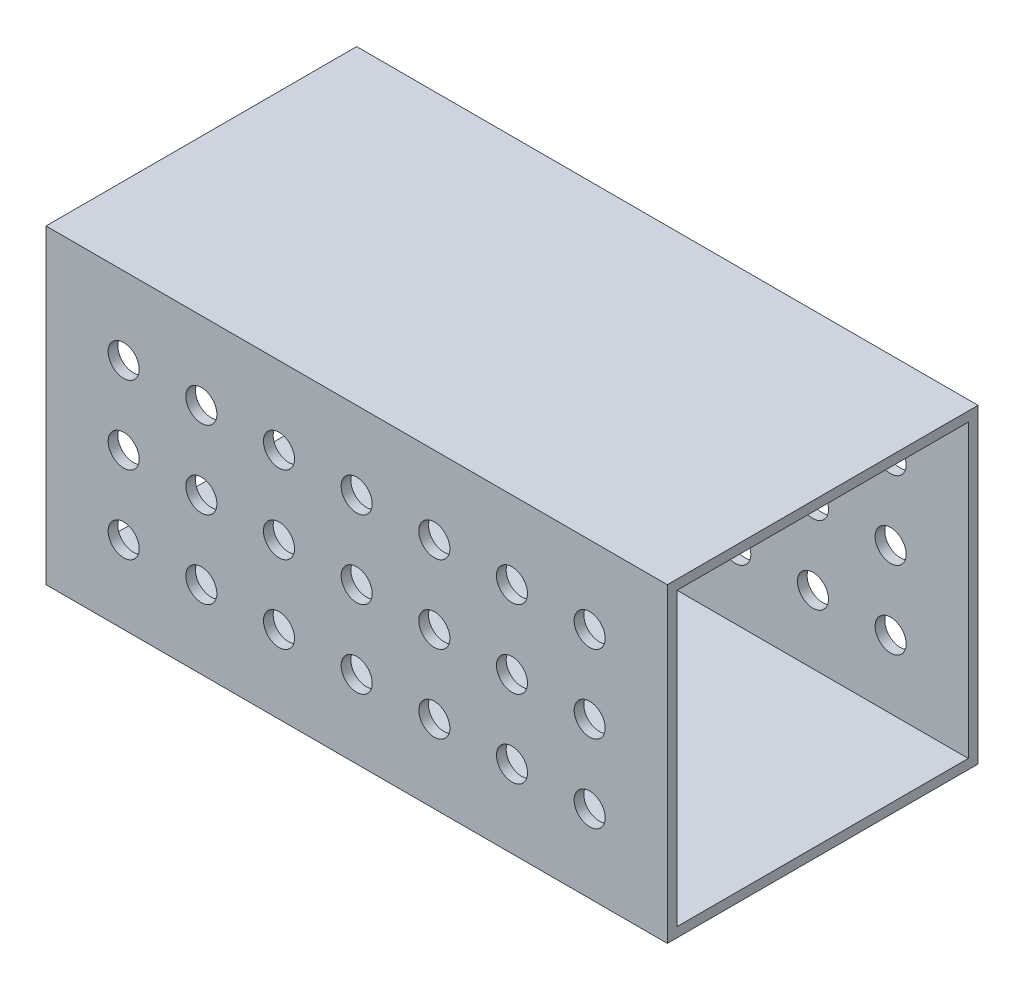
from build123d import *

# Parameters (mm, degrees)
SKETCH1_W           = 50.8
SKETCH1_H           = 50.8
SKETCH1_W_2         = 47.625
SKETCH1_H_2         = 47.625
BOSS_EXTRUDE1_DEPTH = 101.6
SKETCH2_R           = 2.54
CUT_EXTRUDE2_DEPTH  = 609.6


with BuildPart() as part:
    # Sketch1 → Boss-Extrude1 (new body)
    with BuildSketch(Plane(origin=(0, 0, 0), x_dir=(0, 0, -1), z_dir=(1, 0, 0))):
        Rectangle(SKETCH1_W, SKETCH1_H)
        Rectangle(SKETCH1_W_2, SKETCH1_H_2, mode=Mode.SUBTRACT)
    extrude(amount=BOSS_EXTRUDE1_DEPTH)

    # Sketch2 → Cut-Extrude2 (cut)
    with BuildSketch(Plane.XY.offset(25.4)):
        with Locations((12.7, 12.7)):
            Circle(SKETCH2_R)
        with Locations((12.7, 0)):
            Circle(SKETCH2_R)
        with Locations((12.7, -12.7)):
            Circle(SKETCH2_R)
        with Locations((25.4, 12.7)):
            Circle(SKETCH2_R)
        with Locations((25.4, 0)):
            Circle(SKETCH2_R)
        with Locations((25.4, -12.7)):
            Circle(SKETCH2_R)
        with Locations((38.1, 12.7)):
            Circle(SKETCH2_R)
        with Locations((38.1, 0)):
            Circle(SKETCH2_R)
        with Locations((38.1, -12.7)):
            Circle(SKETCH2_R)
        with Locations((50.8, 12.7)):
            Circle(SKETCH2_R)
        with Locations((50.8, 0)):
            Circle(SKETCH2_R)
        with Locations((50.8, -12.7)):
            Circle(SKETCH2_R)
        with Locations((63.5, 12.7)):
            Circle(SKETCH2_R)
        with Locations((63.5, 0)):
            Circle(SKETCH2_R)
        with Locations((63.5, -12.7)):
            Circle(SKETCH2_R)
        with Locations((76.2, 12.7)):
            Circle(SKETCH2_R)
        with Locations((76.2, 0)):
            Circle(SKETCH2_R)
        with Locations((76.2, -12.7)):
            Circle(SKETCH2_R)
        with Locations((88.9, 12.7)):
            Circle(SKETCH2_R)
        with Locations((88.9, 0)):
            Circle(SKETCH2_R)
        with Locations((88.9, -12.7)):
            Circle(SKETCH2_R)
    extrude(amount=-CUT_EXTRUDE2_DEPTH, mode=Mode.SUBTRACT)


solid = part.part
